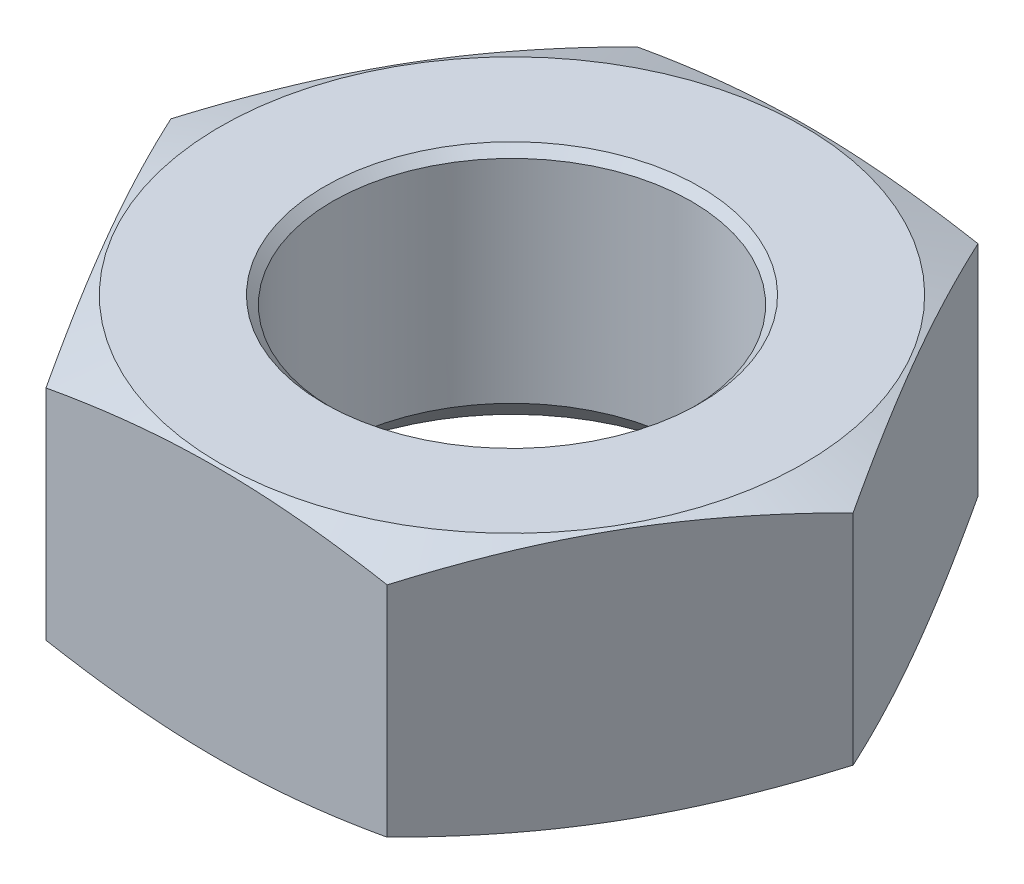
from build123d import *

# Parameters (mm, degrees)
RESSALTO_EXTRUS_O2_DEPTH         = 6
FURO_ROSCADO_DE_M101_D           = 8.5
FURO_ROSCADO_DE_M101_CSINK_D     = 10.05
FURO_ROSCADO_DE_M101_CSINK_ANGLE = 90
CHANFRO2_SIZE                    = 0.2
ESBO_O5_OUTSIDE_W                = 94.042
ESBO_O5_OUTSIDE_H                = 91.876
ESBO_O5_OUTSIDE_R                = 6.914339911
CORTE_EXTRUS_O1_DEPTH            = 13
CORTE_EXTRUS_O1_DRAFT            = -70
ESBO_O6_OUTSIDE_W                = 94.042
ESBO_O6_OUTSIDE_H                = 91.876
ESBO_O6_OUTSIDE_R                = 6.994841317
CORTE_EXTRUS_O2_DEPTH            = 13
CORTE_EXTRUS_O2_DRAFT            = -70


with BuildPart() as part:
    # Esboço1 → Ressalto-extrusão2 (new body)
    with BuildSketch(Plane(origin=(0, 0, 0), x_dir=(1, 0, 0), z_dir=(0, 1, 0))):
        Polygon((4.041451884, 7), (-4.041451884, 7), (-8.082903769, 0), (-4.041451884, -7), (4.041451884, -7), (8.082903769, 0), align=None)
    extrude(amount=RESSALTO_EXTRUS_O2_DEPTH)

    # Furo roscado de M101 (through all)
    with Locations(Plane(origin=(0, 0, 0), x_dir=(-1, 0, 0), z_dir=(0, -1, 0))):
        with Locations((0, 0)):
            CounterSinkHole(FURO_ROSCADO_DE_M101_D / 2, FURO_ROSCADO_DE_M101_CSINK_D / 2, counter_sink_angle=FURO_ROSCADO_DE_M101_CSINK_ANGLE)

    # Chanfro2
    chanfro2_edges = [part.edges().sort_by_distance(p)[0] for p in [
        (-4.25, 6, 0),
    ]]
    chamfer(chanfro2_edges, length=CHANFRO2_SIZE)


with BuildPart() as corte_extrus_o1_tool:
    # Esboço5 outside → Corte-extrusão1 (with draft: the straight prism first)
    with BuildSketch(Plane(origin=(0, 6, 0), x_dir=(1, 0, 0), z_dir=(0, 1, 0))):
        Rectangle(ESBO_O5_OUTSIDE_W, ESBO_O5_OUTSIDE_H)
        Circle(ESBO_O5_OUTSIDE_R, mode=Mode.SUBTRACT)
    extrude(amount=-CORTE_EXTRUS_O1_DEPTH)
    # Corte-extrusão1: the draft: its side faces are tilted about the plane it starts from
    corte_extrus_o1_sides = [corte_extrus_o1_tool.faces().sort_by_distance(p)[0] for p in [
        (0, -0.5, 45.938),
        (47.021, -0.5, 0),
        (0, -0.5, -45.938),
        (-47.021, -0.5, 0),
        (-6.914339911, -0.5, 0),
    ]]
    draft(corte_extrus_o1_sides, Plane(origin=(0, 6, 0), x_dir=(1, 0, 0), z_dir=(0, 1, 0)), CORTE_EXTRUS_O1_DRAFT)


with BuildPart() as part_1:
    add(part.part)

    # Corte-extrusão1: cut by corte_extrus_o1_tool
    add(corte_extrus_o1_tool.part, mode=Mode.SUBTRACT)


with BuildPart() as corte_extrus_o2_tool:
    # Esboço6 outside → Corte-extrusão2 (with draft: the straight prism first)
    with BuildSketch(Plane.XZ):
        Rectangle(ESBO_O6_OUTSIDE_W, ESBO_O6_OUTSIDE_H)
        Circle(ESBO_O6_OUTSIDE_R, mode=Mode.SUBTRACT)
    extrude(amount=-CORTE_EXTRUS_O2_DEPTH)
    # Corte-extrusão2: the draft: its side faces are tilted about the plane it starts from
    corte_extrus_o2_sides = [corte_extrus_o2_tool.faces().sort_by_distance(p)[0] for p in [
        (0, 6.5, -45.938),
        (47.021, 6.5, 0),
        (0, 6.5, 45.938),
        (-47.021, 6.5, 0),
        (-6.994841317, 6.5, 0),
    ]]
    draft(corte_extrus_o2_sides, Plane.XZ, CORTE_EXTRUS_O2_DRAFT)


with BuildPart() as part_2:
    add(part_1.part)

    # Corte-extrusão2: cut by corte_extrus_o2_tool
    add(corte_extrus_o2_tool.part, mode=Mode.SUBTRACT)


solid = part_2.part
